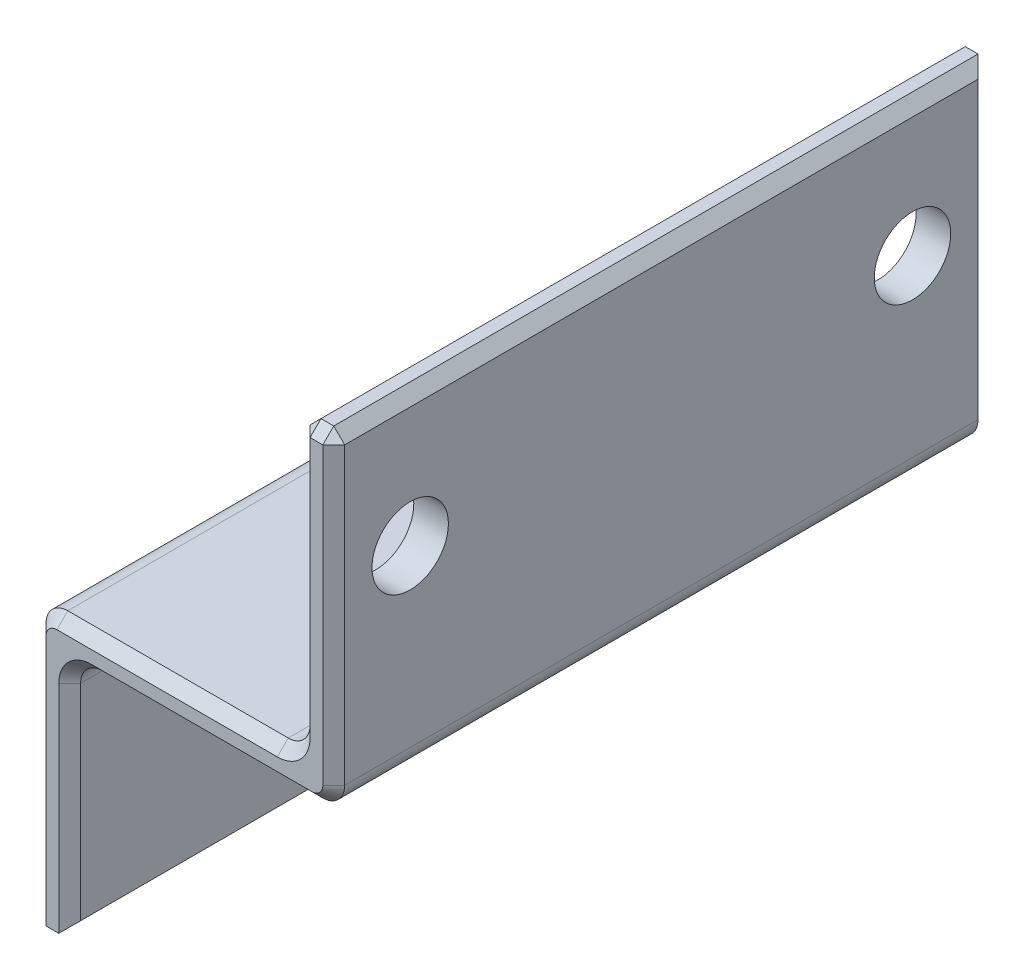
from build123d import *

# Parameters (mm, degrees)
SALIENTE_EXTRUIR1_DEPTH = 60
REDONDEO1_R             = 2
CROQUIS2_R              = 3.5
CORTAR_EXTRUIR1_DEPTH   = 60
CHAFL_N1_SIZE           = 1


with BuildPart() as part:
    # Croquis1 → Saliente-Extruir1 (new body)
    with BuildSketch(Plane.XY):
        Polygon((-16.031190476, -21.01547619), (-16.031190476, 0.81452381), (8.148809524, 0.81452381), (8.148809524, 30.81452381), (4.978809524, 30.81452381), (4.978809524, 3.98452381), (-19.201190476, 3.98452381), (-19.201190476, -21.01547619), align=None)
    extrude(amount=SALIENTE_EXTRUIR1_DEPTH)

    # Redondeo1
    redondeo1_edges = [part.edges().sort_by_distance(p)[0] for p in [
        (-19.201190476, 3.98452381, 30),
        (4.978809524, 3.98452381, 30),
        (8.148809524, 0.81452381, 30),
        (-16.031190476, 0.81452381, 30),
    ]]
    fillet(redondeo1_edges, radius=REDONDEO1_R)

    # Croquis2 → Cortar-Extruir1 (cut)
    with BuildSketch(Plane(origin=(8.148809524, 0, 0), x_dir=(0, 0, -1), z_dir=(1, 0, 0))):
        with Locations((-53, 18.81452381)):
            Circle(CROQUIS2_R)
        with Locations((-7, 18.81452381)):
            Circle(CROQUIS2_R)
    extrude(amount=-CORTAR_EXTRUIR1_DEPTH, mode=Mode.SUBTRACT)

    # Chaflán1
    chafl_n1_edges = [part.edges().sort_by_distance(p)[0] for p in [
        (-16.031190476, -11.10047619, 0),
        (-19.201190476, -21.01547619, 30),
        (4.978809524, 30.81452381, 30),
        (8.148809524, 30.81452381, 30),
        (-16.031190476, -21.01547619, 30),
        (6.563809524, 30.81452381, 60),
        (4.978809524, 18.39952381, 60),
        (-19.201190476, -9.51547619, 0),
        (-19.201190476, -9.51547619, 60),
        (-7.111190476, 3.98452381, 0),
        (8.148809524, 16.81452381, 0),
        (-3.941190476, 0.81452381, 0),
        (7.563023086, 1.400310247, 0),
        (-18.615404039, 3.398737372, 0),
        (-7.111190476, 3.98452381, 60),
        (-3.941190476, 0.81452381, 60),
        (8.148809524, 16.81452381, 60),
        (7.563023086, 1.400310247, 60),
        (-18.615404039, 3.398737372, 60),
        (4.393023086, 4.570310247, 0),
        (4.393023086, 4.570310247, 60),
        (-15.445404039, 0.228737372, 0),
        (-15.445404039, 0.228737372, 60),
        (-16.031190476, -11.10047619, 60),
        (4.978809524, 18.39952381, 0),
    ]]
    chamfer(chafl_n1_edges, length=CHAFL_N1_SIZE)


solid = part.part
